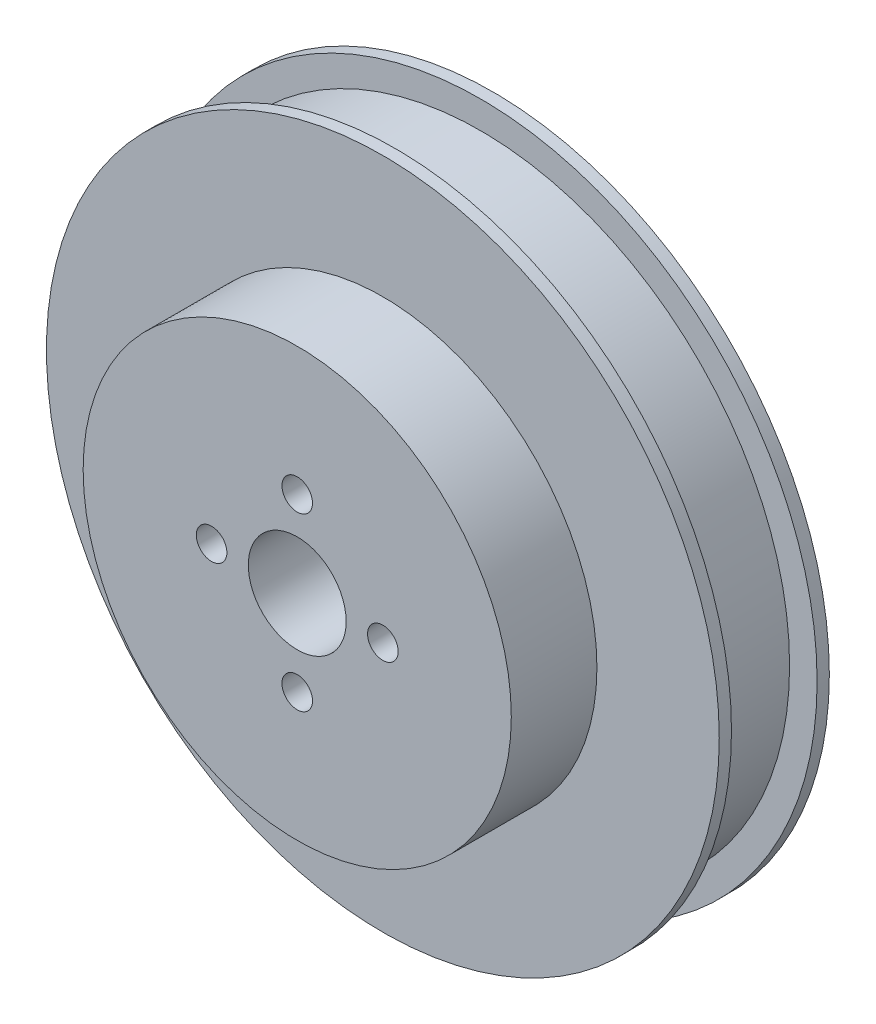
from build123d import *

# Parameters (mm, degrees)
SKETCH_1_R          = 27.5
EXTRUDE_1_DEPTH     = 1
SKETCH_2_R          = 25.25
EXTRUDE_2_DEPTH     = 7
SKETCH_3_R          = 27.5
EXTRUDE_3_DEPTH     = 1
SKETCH_4_R          = 17.5
EXTRUDE_4_DEPTH     = 7
SKETCH_5_R          = 4
CUT_EXTRUDE_1_DEPTH = 100
SKETCH_6_R          = 1.25
CUT_EXTRUDE_2_DEPTH = 100


with BuildPart() as part:
    # 草图1 → 凸台-拉伸1 (new body)
    with BuildSketch(Plane.XY):
        Circle(SKETCH_1_R)
    extrude(amount=EXTRUDE_1_DEPTH)

    # 草图2 → 凸台-拉伸2 (add)
    with BuildSketch(Plane.XY.offset(1)):
        Circle(SKETCH_2_R)
    extrude(amount=EXTRUDE_2_DEPTH)

    # 草图3 → 凸台-拉伸3 (add)
    with BuildSketch(Plane.XY.offset(8)):
        Circle(SKETCH_3_R)
    extrude(amount=EXTRUDE_3_DEPTH)

    # 草图4 → 凸台-拉伸4 (add)
    with BuildSketch(Plane.XY.offset(9)):
        Circle(SKETCH_4_R)
    extrude(amount=EXTRUDE_4_DEPTH)

    # 草图5 → 切除-拉伸1 (cut)
    with BuildSketch(Plane.XY.offset(16)):
        Circle(SKETCH_5_R)
    extrude(amount=-CUT_EXTRUDE_1_DEPTH, mode=Mode.SUBTRACT)

    # 草图6 → 切除-拉伸2 (cut)
    with BuildSketch(Plane(origin=(0, 0, 0), x_dir=(-1, 0, 0), z_dir=(0, 0, -1))):
        with Locations((7, 0)):
            Circle(SKETCH_6_R)
        with Locations((0, -7)):
            Circle(SKETCH_6_R)
        with Locations((-7, 0)):
            Circle(SKETCH_6_R)
        with Locations((0, 7)):
            Circle(SKETCH_6_R)
    extrude(amount=-CUT_EXTRUDE_2_DEPTH, mode=Mode.SUBTRACT)


solid = part.part
